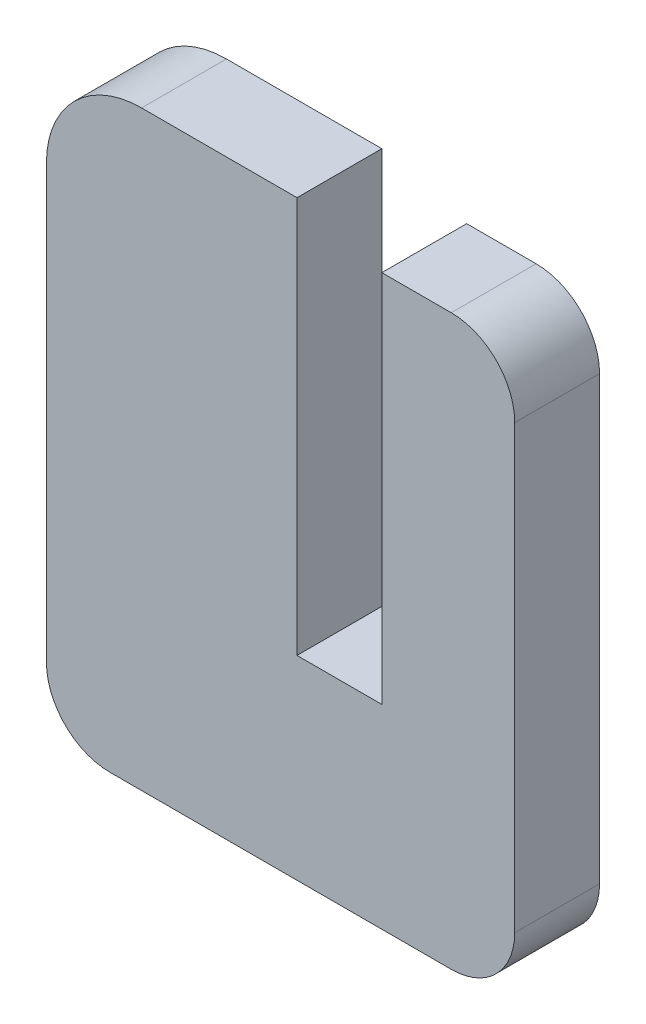
from build123d import *

# Parameters (mm, degrees)
BOSS_EXTRUDE1_DEPTH = 5.35


with BuildPart() as part:
    # Model → Boss-Extrude1 (new body)
    with BuildSketch(Plane.XY):
        with BuildLine():
            Line((6.385, 35.86), (10.765, 35.86))
            ThreePointArc((10.765, 35.86), (13.593427125, 34.688427125), (14.765, 31.86))
            Line((14.765, 31.86), (14.765, 4))
            ThreePointArc((14.765, 4), (13.593427125, 1.171572875), (10.765, 0))
            Line((10.765, 0), (-10.765, 0))
            ThreePointArc((-10.765, 0), (-13.593427125, 1.171572875), (-14.765, 4))
            Line((-14.765, 4), (-14.765, 31.28))
            ThreePointArc((-14.765, 31.28), (-13.007640687, 35.522640687), (-8.765, 37.28))
            Line((-8.765, 37.28), (1.035, 37.28))
            Line((1.035, 37.28), (1.035, 12.28))
            Line((1.035, 12.28), (6.385, 12.28))
            Line((6.385, 12.28), (6.385, 35.86))
        make_face()
    extrude(amount=BOSS_EXTRUDE1_DEPTH)


solid = part.part
